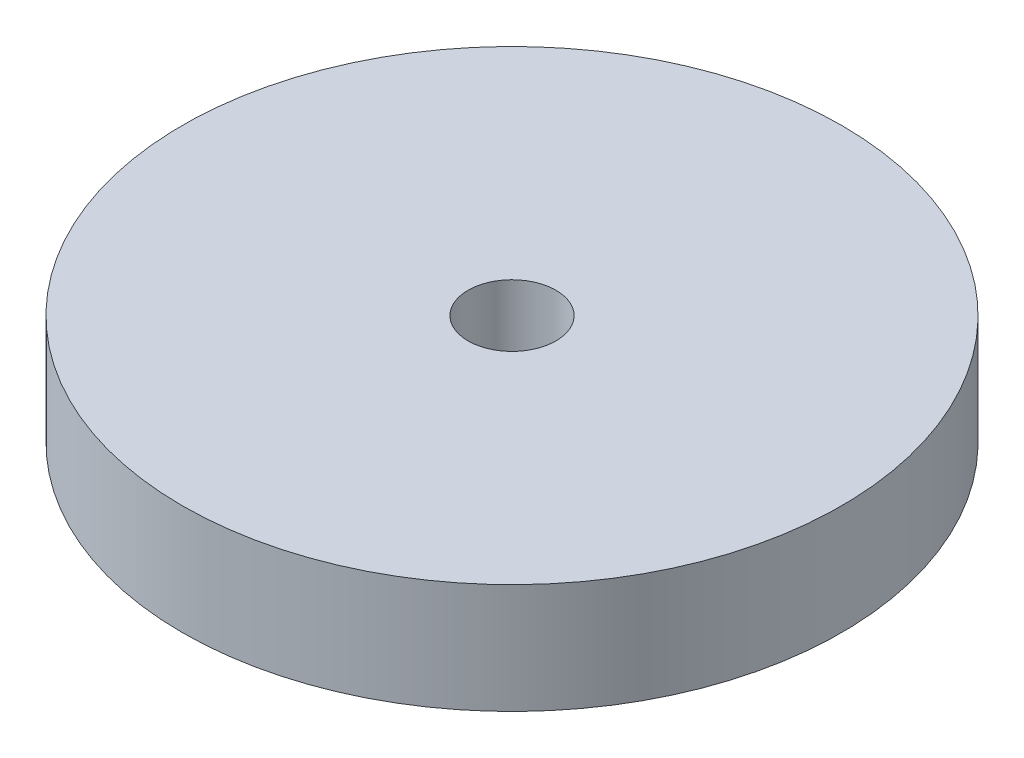
from build123d import *

# Parameters (mm, degrees)
SKETCH1_R           = 30
SKETCH1_R_2         = 4
BOSS_EXTRUDE1_DEPTH = 10


with BuildPart() as part:
    # Sketch1 → Boss-Extrude1 (new body)
    with BuildSketch(Plane(origin=(0, 0, 0), x_dir=(1, 0, 0), z_dir=(0, 1, 0))):
        with Locations(Location((0, 0, 0), (0, 0, 270))):
            Circle(SKETCH1_R)
        with Locations(Location((0, 0, 0), (0, 0, 270))):
            Circle(SKETCH1_R_2, mode=Mode.SUBTRACT)
    extrude(amount=BOSS_EXTRUDE1_DEPTH)


solid = part.part
